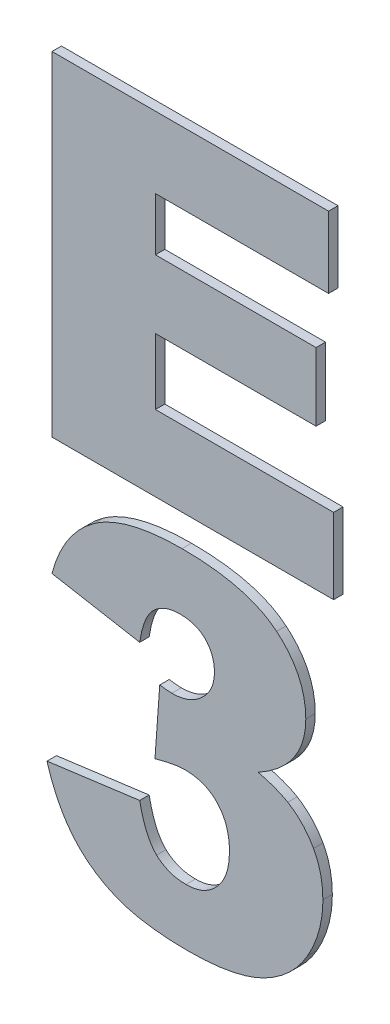
from build123d import *

# Parameters (mm, degrees)
BOSS_EXTRUDE1_DEPTH   = 10
BOSS_EXTRUDE1_2_DEPTH = 10


with BuildPart() as part:
    # Sketch1 → Boss-Extrude1 (new body)
    with BuildSketch(Plane.XY):
        Polygon((-144.211144, 752.50763293), (148.55197, 752.50763293), (148.55197, 677.02589093), (-34.726412, 677.02589093), (-34.726412, 620.83659693), (135.288398, 620.83659693), (135.288398, 548.73101093), (-34.726412, 548.73101093), (-34.726412, 479.03698093), (153.857396, 479.03698093), (153.857396, 398.97330493), (-144.211144, 398.97330493), align=None)
    extrude(amount=BOSS_EXTRUDE1_DEPTH)


with BuildPart() as body_2:
    # Sketch1 → Boss-Extrude1 2 (new body)
    with BuildSketch(Plane.XY):
        with BuildLine():
            Line((-51.366168, 257.313168), (-144.211144, 273.952938))
            add(Edge.make_bspline(
                [(-144.211144, 273.952938), (-136.494162, 303.534714), (-121.703274, 326.20336), (-99.838466, 341.958862)],
                knots=[0, 0, 0, 0, 1, 1, 1, 1], degree=3))
            add(Edge.make_bspline(
                [(-99.838466, 341.958862), (-77.812896, 357.714378), (-46.703804, 365.592122), (-6.511176, 365.592122)],
                knots=[0, 0, 0, 0, 1, 1, 1, 1], degree=3))
            add(Edge.make_bspline(
                [(-6.511176, 365.592122), (39.62994, 365.592122), (72.989812, 356.9909), (93.568468, 339.788456)],
                knots=[0, 0, 0, 0, 1, 1, 1, 1], degree=3))
            add(Edge.make_bspline(
                [(93.568468, 339.788456), (114.147082, 322.585998), (124.436396, 300.962382), (124.436396, 274.91758)],
                knots=[0, 0, 0, 0, 1, 1, 1, 1], degree=3))
            add(Edge.make_bspline(
                [(124.436396, 274.91758), (124.436396, 259.644378), (120.25636, 245.818104), (111.896288, 233.438772)],
                knots=[0, 0, 0, 0, 1, 1, 1, 1], degree=3))
            add(Edge.make_bspline(
                [(111.896288, 233.438772), (103.536216, 221.05944), (90.915734, 210.207438), (74.034828, 200.882752)],
                knots=[0, 0, 0, 0, 1, 1, 1, 1], degree=3))
            add(Edge.make_bspline(
                [(74.034828, 200.882752), (87.700312, 197.506554), (98.150402, 193.567668), (105.38507, 189.066094)],
                knots=[0, 0, 0, 0, 1, 1, 1, 1], degree=3))
            add(Edge.make_bspline(
                [(105.38507, 189.066094), (117.121312, 181.831426), (126.204848, 172.26559), (132.635664, 160.368586)],
                knots=[0, 0, 0, 0, 1, 1, 1, 1], degree=3))
            add(Edge.make_bspline(
                [(132.635664, 160.368586), (139.22727, 148.632316), (142.52308, 134.564906), (142.52308, 118.166328)],
                knots=[0, 0, 0, 0, 1, 1, 1, 1], degree=3))
            add(Edge.make_bspline(
                [(142.52308, 118.166328), (142.52308, 97.587686), (137.137266, 77.812896), (126.365638, 58.841986)],
                knots=[0, 0, 0, 0, 1, 1, 1, 1], degree=3))
            add(Edge.make_bspline(
                [(126.365638, 58.841986), (115.59401, 40.031838), (100.079658, 25.4821), (79.822582, 15.192814)],
                knots=[0, 0, 0, 0, 1, 1, 1, 1], degree=3))
            add(Edge.make_bspline(
                [(79.822582, 15.192814), (59.565478, 5.064276), (32.957946, 0), (0, 0)],
                knots=[0, 0, 0, 0, 1, 1, 1, 1], degree=3))
            add(Edge.make_bspline(
                [(0, 0), (-32.154108, 0), (-57.555834, 3.778096), (-76.205206, 11.334288)],
                knots=[0, 0, 0, 0, 1, 1, 1, 1], degree=3))
            add(Edge.make_bspline(
                [(-76.205206, 11.334288), (-94.693816, 18.890508), (-109.967018, 29.9033), (-122.024798, 44.372636)],
                knots=[0, 0, 0, 0, 1, 1, 1, 1], degree=3))
            add(Edge.make_bspline(
                [(-122.024798, 44.372636), (-133.92183, 59.002776), (-143.085754, 77.33061), (-149.51657, 99.356152)],
                knots=[0, 0, 0, 0, 1, 1, 1, 1], degree=3))
            Line((-149.51657, 99.356152), (-51.366168, 112.378574))
            add(Edge.make_bspline(
                [(-51.366168, 112.378574), (-47.50767, 92.603812), (-41.559154, 78.85794), (-33.520634, 71.140958)],
                knots=[0, 0, 0, 0, 1, 1, 1, 1], degree=3))
            add(Edge.make_bspline(
                [(-33.520634, 71.140958), (-25.321338, 63.584738), (-14.95165, 59.806628), (-2.411556, 59.806628)],
                knots=[0, 0, 0, 0, 1, 1, 1, 1], degree=3))
            add(Edge.make_bspline(
                [(-2.411556, 59.806628), (10.771628, 59.806628), (21.704032, 64.62974), (30.385642, 74.275978)],
                knots=[0, 0, 0, 0, 1, 1, 1, 1], degree=3))
            add(Edge.make_bspline(
                [(30.385642, 74.275978), (39.228028, 83.922202), (43.649214, 96.783848), (43.649214, 112.860888)],
                knots=[0, 0, 0, 0, 1, 1, 1, 1], degree=3))
            add(Edge.make_bspline(
                [(43.649214, 112.860888), (43.649214, 129.259494), (39.388804, 141.960364), (30.86797, 150.963498)],
                knots=[0, 0, 0, 0, 1, 1, 1, 1], degree=3))
            add(Edge.make_bspline(
                [(30.86797, 150.963498), (22.507898, 159.966632), (11.09318, 164.468206), (-3.376156, 164.468206)],
                knots=[0, 0, 0, 0, 1, 1, 1, 1], degree=3))
            add(Edge.make_bspline(
                [(-3.376156, 164.468206), (-11.093138, 164.468206), (-21.70399, 162.538964), (-35.208726, 158.680494)],
                knots=[0, 0, 0, 0, 1, 1, 1, 1], degree=3))
            Line((-35.208726, 158.680494), (-30.144478, 228.856796))
            add(Edge.make_bspline(
                [(-30.144478, 228.856796), (-24.678262, 228.052944), (-20.417838, 227.651018), (-17.363192, 227.651018)],
                knots=[0, 0, 0, 0, 1, 1, 1, 1], degree=3))
            add(Edge.make_bspline(
                [(-17.363192, 227.651018), (-4.501546, 227.651018), (6.189694, 231.75068), (14.710528, 239.94999)],
                knots=[0, 0, 0, 0, 1, 1, 1, 1], degree=3))
            add(Edge.make_bspline(
                [(14.710528, 239.94999), (23.39211, 248.149272), (27.732908, 257.875884), (27.732908, 269.129826)],
                knots=[0, 0, 0, 0, 1, 1, 1, 1], degree=3))
            add(Edge.make_bspline(
                [(27.732908, 269.129826), (27.732908, 279.901454), (24.5175, 288.502676), (18.086684, 294.933492)],
                knots=[0, 0, 0, 0, 1, 1, 1, 1], degree=3))
            add(Edge.make_bspline(
                [(18.086684, 294.933492), (11.655854, 301.364308), (2.813482, 304.57973), (-8.44046, 304.57973)],
                knots=[0, 0, 0, 0, 1, 1, 1, 1], degree=3))
            add(Edge.make_bspline(
                [(-8.44046, 304.57973), (-20.015912, 304.57973), (-29.420972, 301.04277), (-36.655654, 293.96885)],
                knots=[0, 0, 0, 0, 1, 1, 1, 1], degree=3))
            add(Edge.make_bspline(
                [(-36.655654, 293.96885), (-43.890322, 287.055734), (-48.793836, 274.837164), (-51.366168, 257.313168)],
                knots=[0, 0, 0, 0, 1, 1, 1, 1], degree=3))
        make_face()
    extrude(amount=BOSS_EXTRUDE1_2_DEPTH)


solid = Compound([part.part, body_2.part])
